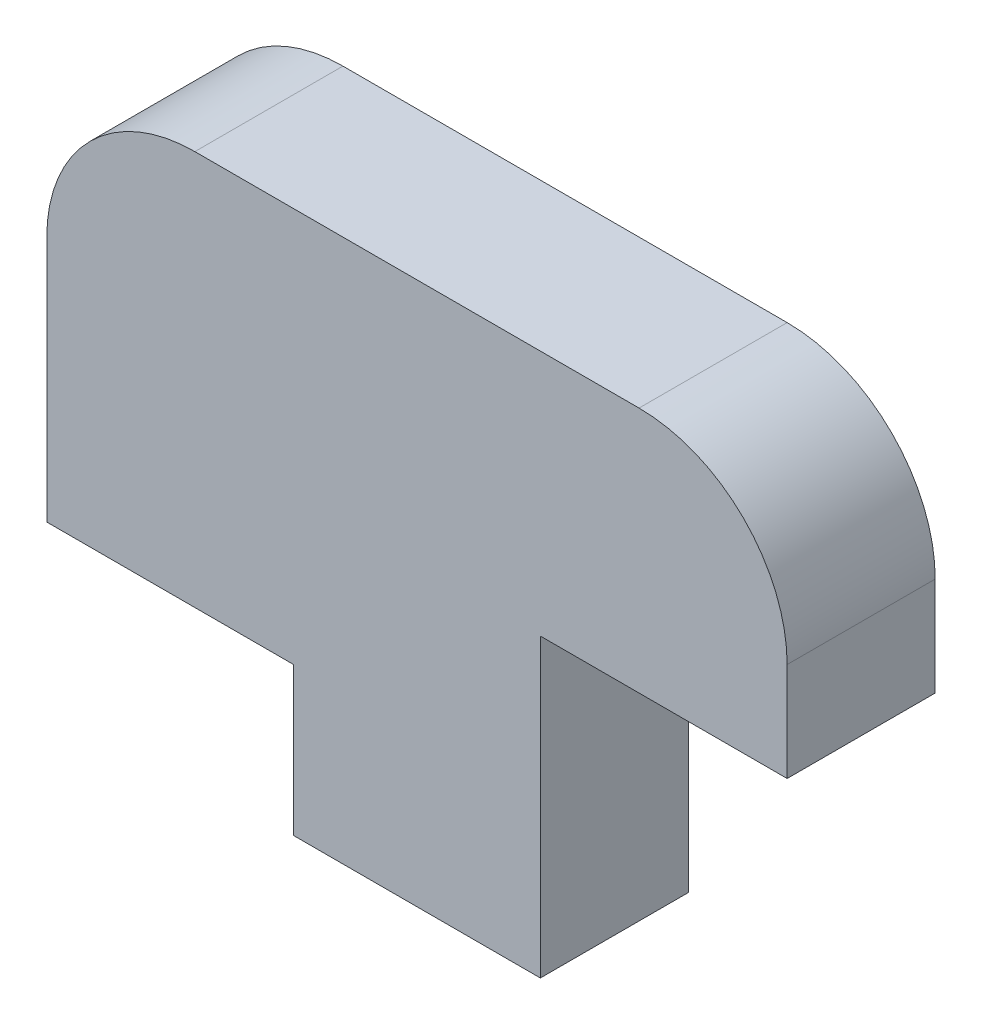
from build123d import *

# Parameters (mm, degrees)
BOSS_EXTRUDE1_DEPTH = 3


with BuildPart() as part:
    # Sketch1 → Boss-Extrude1 (new body)
    with BuildSketch(Plane.XY):
        with BuildLine():
            Line((-10, 3), (-5, 3))
            Line((-5, 3), (-5, 0))
            Line((-5, 0), (0, 0))
            Line((0, 0), (0, 6))
            Line((0, 6), (5, 6))
            Line((5, 6), (5, 8))
            ThreePointArc((5, 8), (4.121320344, 10.121320344), (2, 11))
            Line((2, 11), (-7, 11))
            ThreePointArc((-7, 11), (-9.121320344, 10.121320344), (-10, 8))
            Line((-10, 8), (-10, 3))
        make_face()
    extrude(amount=BOSS_EXTRUDE1_DEPTH)


solid = part.part
